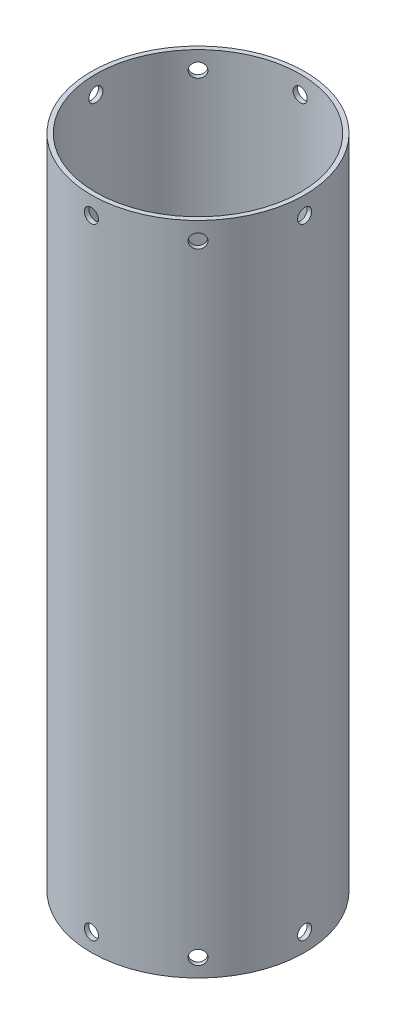
from build123d import *

# Parameters (mm, degrees)
SKETCH1_R               = 76.2
SKETCH1_R_2             = 73.025
BOSS_EXTRUDE1_DEPTH     = 467.995
CUT_EXTRUDE1_REACH      = 457.525
CUT_EXTRUDE1_END_RADIUS = 76.2
SKETCH4_R               = 5.0165
CIRPATTERN3_COUNT       = 8
CUT_EXTRUDE2_REACH      = 457.525
CUT_EXTRUDE2_END_RADIUS = 76.2
SKETCH7_R               = 5.0165
CIRPATTERN4_COUNT       = 8


with BuildPart() as part:
    # Sketch1 → Boss-Extrude1 (new body)
    with BuildSketch(Plane(origin=(0, 0, 0), x_dir=(1, 0, 0), z_dir=(0, 1, 0))):
        with Locations(Location((0, 0, 0), (0, 0, 270))):
            Circle(SKETCH1_R)
        with Locations(Location((0, 0, 0), (0, 0, 270))):
            Circle(SKETCH1_R_2, mode=Mode.SUBTRACT)
    extrude(amount=BOSS_EXTRUDE1_DEPTH)

    # Cut-Extrude1: up to this cylinder (the profile starts inside it)
    cut_extrude1_end = Plane(origin=(0, 455.295, 0), z_dir=(0, -1, 0)) * Cylinder(CUT_EXTRUDE1_END_RADIUS, 1068.45, mode=Mode.PRIVATE)
    # Sketch4 → Cut-Extrude1 (cut, up to the surface)
    with BuildSketch(Plane(origin=(0, 442.595, 0), x_dir=(0, 0, 1), z_dir=(1, 0, 0)), mode=Mode.PRIVATE) as cut_extrude1_sk1:
        with Locations((0, -12.7)):
            Circle(SKETCH4_R)
    cut_extrude1_tool1 = extrude(cut_extrude1_sk1.sketch, amount=CUT_EXTRUDE1_REACH, mode=Mode.PRIVATE) & cut_extrude1_end
    cut_extrude1 = cut_extrude1_tool1.solids().sort_by_distance((0, 455.295, 0))[0]
    add(cut_extrude1, mode=Mode.SUBTRACT)

    # CirPattern3: Cut-Extrude1 ×8 about axis
    cirpattern3_axis = Axis((0, 467.995, 0), (0, 1, 0))
    for i in range(1, CIRPATTERN3_COUNT):
        add(cut_extrude1.rotate(cirpattern3_axis, i * 360 / CIRPATTERN3_COUNT), mode=Mode.SUBTRACT)

    # Cut-Extrude2: up to this cylinder (the profile starts inside it)
    cut_extrude2_end = Plane(origin=(0, 12.7, 0), z_dir=(0, -1, 0)) * Cylinder(CUT_EXTRUDE2_END_RADIUS, 1068.45, mode=Mode.PRIVATE)
    # Sketch7 → Cut-Extrude2 (cut, up to the surface)
    with BuildSketch(Plane(origin=(0, 25.4, 0), x_dir=(0, 0, -1), z_dir=(1, 0, 0)), mode=Mode.PRIVATE) as cut_extrude2_sk1:
        with Locations(Location((0, -12.7, 0), (0, 0, 180))):
            Circle(SKETCH7_R)
    cut_extrude2_tool1 = extrude(cut_extrude2_sk1.sketch, amount=CUT_EXTRUDE2_REACH, mode=Mode.PRIVATE) & cut_extrude2_end
    cut_extrude2 = cut_extrude2_tool1.solids().sort_by_distance((0, 12.7, 0))[0]
    add(cut_extrude2, mode=Mode.SUBTRACT)

    # CirPattern4: Cut-Extrude2 ×8 about axis
    cirpattern4_axis = Axis((0, 0, 0), (0, 1, 0))
    for i in range(1, CIRPATTERN4_COUNT):
        add(cut_extrude2.rotate(cirpattern4_axis, i * 360 / CIRPATTERN4_COUNT), mode=Mode.SUBTRACT)


solid = part.part
